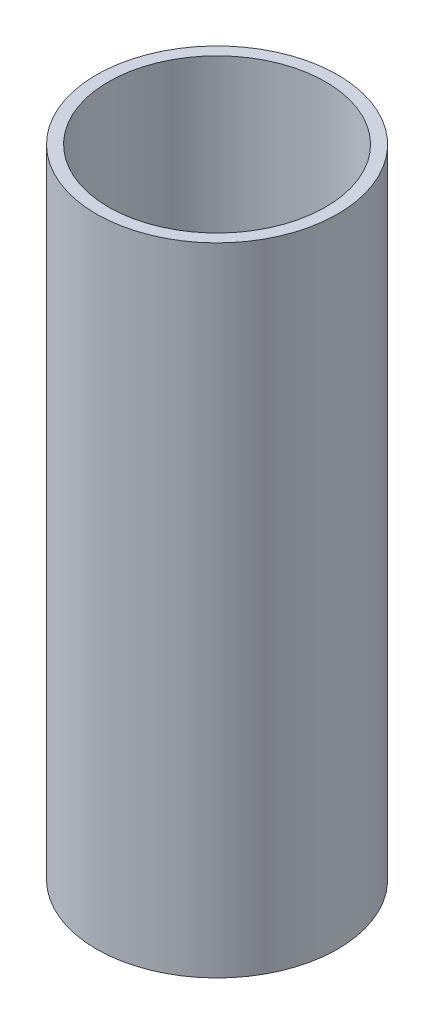
from build123d import *

# Parameters (mm, degrees)
SKETCH1_R           = 57.15
SKETCH1_R_2         = 51.435
BOSS_EXTRUDE1_DEPTH = 150.8125


with BuildPart() as part:
    # Sketch1 → Boss-Extrude1 (new, symmetric)
    with BuildSketch(Plane(origin=(0, 0, 0), x_dir=(1, 0, 0), z_dir=(0, 1, 0))):
        with Locations(Location((0, 0, 0), (0, 0, 270))):
            Circle(SKETCH1_R)
        with Locations(Location((0, 0, 0), (0, 0, 270))):
            Circle(SKETCH1_R_2, mode=Mode.SUBTRACT)
    extrude(amount=BOSS_EXTRUDE1_DEPTH, both=True)


solid = part.part
